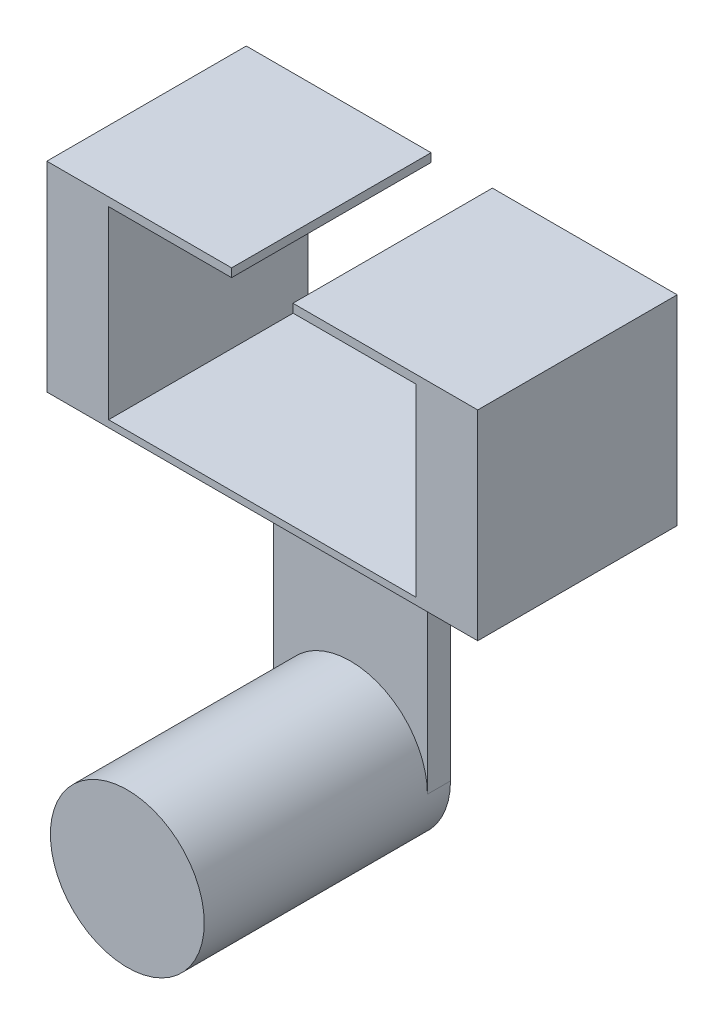
from build123d import *

# Parameters (mm, degrees)
SKETCH1_R           = 15.875
BOSS_EXTRUDE1_DEPTH = 50.8
SKETCH2_W           = 31.75
SKETCH2_H           = 50.8
BOSS_EXTRUDE2_DEPTH = 4.7625
SKETCH3_W           = 88.9
SKETCH3_H           = 41.148
BOSS_EXTRUDE3_DEPTH = 41.2496
CUT_EXTRUDE2_DEPTH  = 111.191148756


with BuildPart() as part:
    # Sketch1 → Boss-Extrude1 (new body)
    with BuildSketch(Plane.XY):
        Circle(SKETCH1_R)
    extrude(amount=BOSS_EXTRUDE1_DEPTH)

    # Sketch2 → Boss-Extrude2 (add)
    with BuildSketch(Plane(origin=(0, 0, 0), x_dir=(-1, 0, 0), z_dir=(0, 0, -1))):
        with Locations((0, 25.4)):
            Rectangle(SKETCH2_W, SKETCH2_H)
    extrude(amount=-BOSS_EXTRUDE2_DEPTH)

    # Sketch3 → Boss-Extrude3 (add)
    with BuildSketch(Plane(origin=(0, 50.8, 0), x_dir=(1, 0, 0), z_dir=(0, 1, 0))):
        with Locations((0, -2.38125)):
            Rectangle(SKETCH3_W, SKETCH3_H)
    extrude(amount=BOSS_EXTRUDE3_DEPTH)

    # Sketch5 → Cut-Extrude2 (cut, through all)
    with BuildSketch(Plane.XY.offset(22.95525)):
        Polygon((-6.3246, 92.0496), (-6.3246, 90.297), (-31.70428, 90.297), (-31.70428, 52.2224), (31.70428, 52.2224), (31.70428, 90.297), (6.3246, 90.297), (6.3246, 92.0496), align=None)
    extrude(amount=-CUT_EXTRUDE2_DEPTH, mode=Mode.SUBTRACT)


solid = part.part
